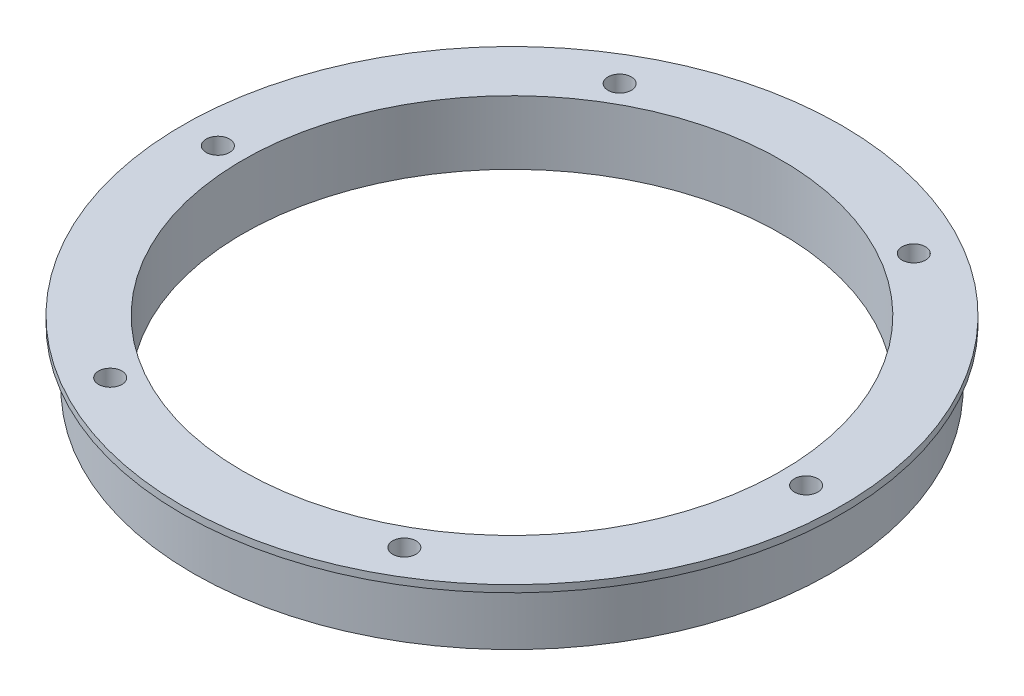
from build123d import *

# Parameters (mm, degrees)
SKETCH_2_R         = 45
SKETCH_2_R_2       = 38
EXTRUDE_1_DEPTH    = 8
SKETCH_6_R         = 46.5
SKETCH_6_R_2       = 38
EXTRUDE_3_DEPTH    = 1
HOLE_WIZARD_M4_1_D = 3.3


with BuildPart() as part:
    # 草图2 → 凸台-拉伸1 (new body)
    with BuildSketch(Plane(origin=(0, 0, 0), x_dir=(1, 0, 0), z_dir=(0, 1, 0))):
        with Locations(Location((0, 0, 0), (0, 0, 270))):
            Circle(SKETCH_2_R)
        with Locations(Location((0, 0, 0), (0, 0, 270))):
            Circle(SKETCH_2_R_2, mode=Mode.SUBTRACT)
    extrude(amount=EXTRUDE_1_DEPTH)

    # 草图6 → 凸台-拉伸3 (add)
    with BuildSketch(Plane(origin=(0, 8, 0), x_dir=(1, 0, 0), z_dir=(0, 1, 0))):
        with Locations(Location((0, 0, 0), (0, 0, 270))):
            Circle(SKETCH_6_R)
        with Locations(Location((0, 0, 0), (0, 0, 270))):
            Circle(SKETCH_6_R_2, mode=Mode.SUBTRACT)
    extrude(amount=EXTRUDE_3_DEPTH)

    # M4 螺纹孔1 (through all)
    with Locations(Plane(origin=(0, 9, 0), x_dir=(1, 0, 0), z_dir=(0, 1, 0))):
        with Locations((-20.75, 35.940054257), (20.75, 35.940054257), (41.5, 0), (20.75, -35.940054257), (-20.75, -35.940054257), (-41.5, 0)):
            Hole(HOLE_WIZARD_M4_1_D / 2)


solid = part.part
